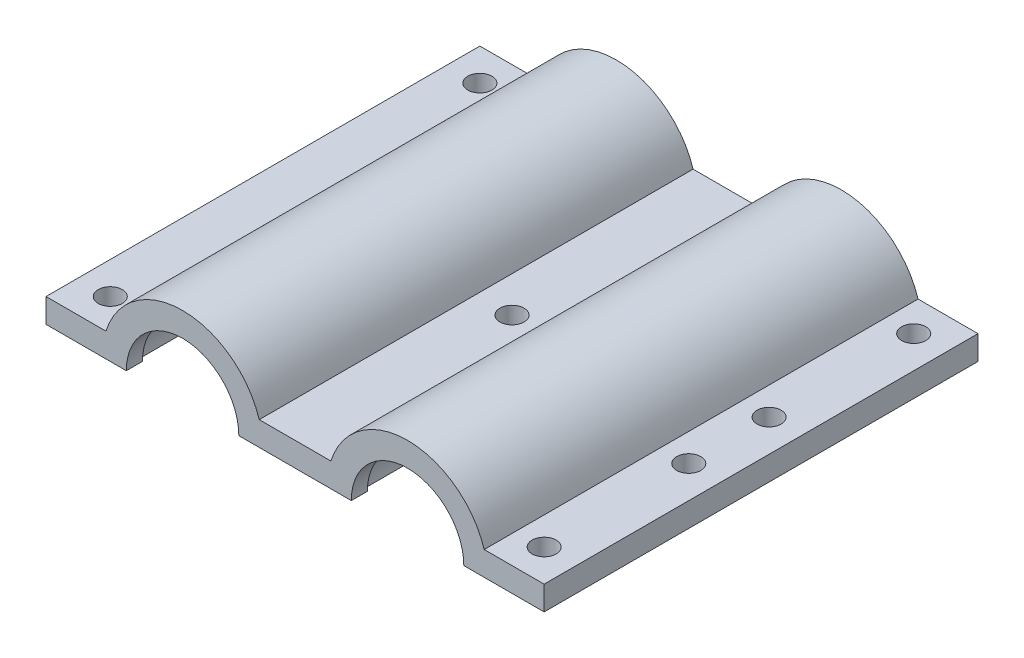
from build123d import *

# Parameters (mm, degrees)
BOSS_EXTRUDE1_DEPTH = 27
BOSS_EXTRUDE2_DEPTH = 2
BOSS_EXTRUDE3_DEPTH = 1
SKETCH4_R           = 1.5
CUT_EXTRUDE1_DEPTH  = 42.701318924
SKETCH5_R           = 1.5
CUT_EXTRUDE2_DEPTH  = 10


with BuildPart() as part:
    # Sketch1 → Boss-Extrude1 (new, symmetric)
    with BuildSketch(Plane.XY):
        with BuildLine():
            Line((-31, 3), (-23.539392014, 3))
            ThreePointArc((-23.539392014, 3), (-14, 10), (-4.460607986, 3))
            Line((-4.460607986, 3), (4.460607986, 3))
            ThreePointArc((4.460607986, 3), (14, 10), (23.539392014, 3))
            Line((23.539392014, 3), (31, 3))
            Line((31, 3), (31, 0))
            Line((31, 0), (21.5, 0))
            ThreePointArc((21.5, 0), (14, 7.5), (6.5, 0))
            Line((6.5, 0), (-6.5, 0))
            ThreePointArc((-6.5, 0), (-14, 7.5), (-21.5, 0))
            Line((-21.5, 0), (-31, 0))
            Line((-31, 0), (-31, 3))
        make_face()
    extrude(amount=BOSS_EXTRUDE1_DEPTH, both=True)

    # Sketch2 → Boss-Extrude2 (add)
    with BuildSketch(Plane.XY.offset(27)):
        with BuildLine():
            Line((-22, 0), (-21, 0))
            ThreePointArc((-21, 0), (-14, 7), (-7, 0))
            Line((-7, 0), (-6, 0))
            ThreePointArc((-6, 0), (-14, 8), (-22, 0))
        make_face()
        with BuildLine():
            Line((21, 0), (22, 0))
            ThreePointArc((22, 0), (14, 8), (6, 0))
            Line((6, 0), (7, 0))
            ThreePointArc((7, 0), (14, 7), (21, 0))
        make_face()
    boss_extrude2 = extrude(amount=-BOSS_EXTRUDE2_DEPTH)

    # Mirror1: Boss-Extrude2 across plane
    add(boss_extrude2.mirror(Plane.XY))

    # Sketch3 → Boss-Extrude3 (add, symmetric)
    with BuildSketch(Plane.XY):
        with BuildLine():
            Line((-22, 0), (-21, 0))
            ThreePointArc((-21, 0), (-14, 7), (-7, 0))
            Line((-7, 0), (-6, 0))
            ThreePointArc((-6, 0), (-14, 8), (-22, 0))
        make_face()
        with BuildLine():
            Line((6, 0), (7, 0))
            ThreePointArc((7, 0), (14, 7), (21, 0))
            Line((21, 0), (22, 0))
            ThreePointArc((22, 0), (14, 8), (6, 0))
        make_face()
    extrude(amount=BOSS_EXTRUDE3_DEPTH, both=True)

    # Sketch4 → Cut-Extrude1 (cut, through all)
    with BuildSketch(Plane(origin=(0, 3, 0), x_dir=(1, 0, 0), z_dir=(0, 1, 0))):
        with Locations(Location((-27, 23, 0), (0, 0, 270))):
            Circle(SKETCH4_R)
        with Locations(Location((-27, -23, 0), (0, 0, 270))):
            Circle(SKETCH4_R)
        with Locations(Location((27, -23, 0), (0, 0, 270))):
            Circle(SKETCH4_R)
        with Locations(Location((27, 23, 0), (0, 0, 270))):
            Circle(SKETCH4_R)
        with Locations(Location((0, 0, 0), (0, 0, 270))):
            Circle(SKETCH4_R)
    extrude(amount=-CUT_EXTRUDE1_DEPTH, mode=Mode.SUBTRACT)

    # Sketch5 → Cut-Extrude2 (cut)
    with BuildSketch(Plane(origin=(0, 3, 0), x_dir=(1, 0, 0), z_dir=(0, 1, 0))):
        with Locations(Location((27, 5, 0), (0, 0, 270))):
            Circle(SKETCH5_R)
        with Locations(Location((27, -5, 0), (0, 0, 270))):
            Circle(SKETCH5_R)
    extrude(amount=-CUT_EXTRUDE2_DEPTH, mode=Mode.SUBTRACT)


solid = part.part
